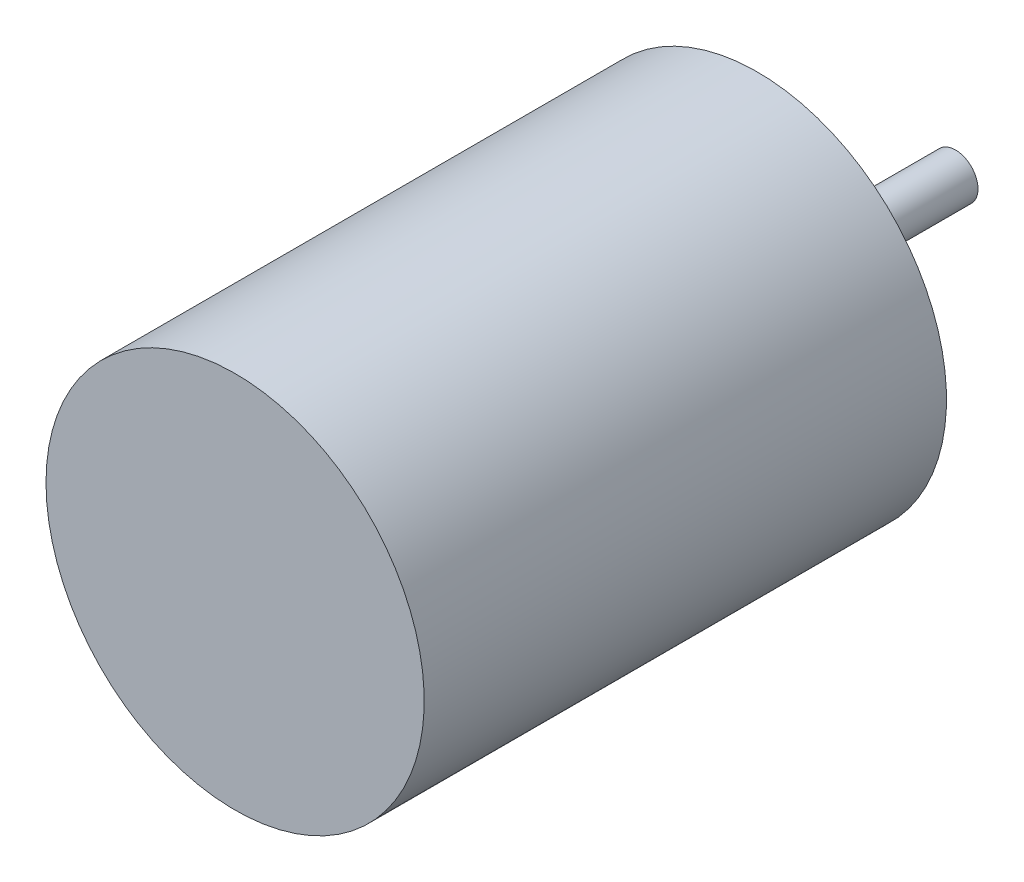
from build123d import *

# Parameters (mm, degrees)
SKETCH1_R         = 21
EXTRUDE_296_DEPTH = 58
SKETCH2_R         = 2.5
EXTRUDE_389_DEPTH = 22


with BuildPart() as part:
    # Sketch1 → Extrude 296 (new body)
    with BuildSketch(Plane.XY):
        with Locations((75.771006381, -68.582665129)):
            Circle(SKETCH1_R)
    extrude(amount=EXTRUDE_296_DEPTH)

    # Sketch2 → Extrude 389 (add)
    with BuildSketch(Plane(origin=(0, 0, 0), x_dir=(-1, 0, 0), z_dir=(0, 0, -1))):
        with Locations((-75.771006381, -68.582665129)):
            Circle(SKETCH2_R)
    extrude(amount=EXTRUDE_389_DEPTH)


solid = part.part
